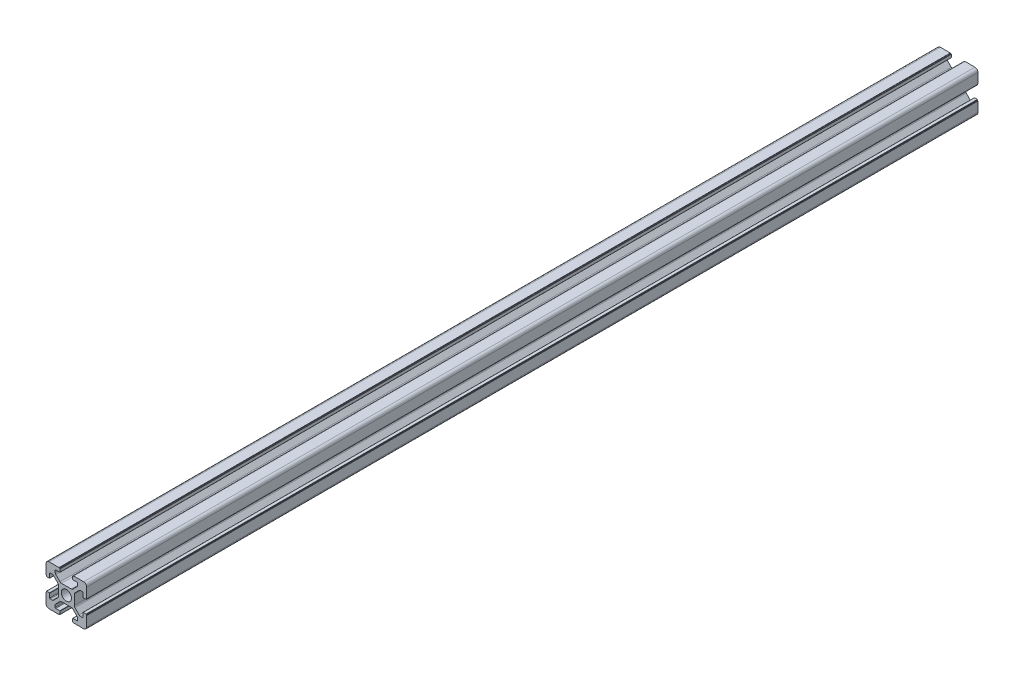
from build123d import *

# Parameters (mm, degrees)
SKETCH_1_R      = 2.5
EXTRUDE_1_DEPTH = 438
FILLET_1_R      = 1.5


with BuildPart() as part:
    # 草图1 → 凸台-拉伸1 (new body)
    with BuildSketch(Plane.XY):
        with BuildLine():
            Line((20, 13.6), (20, 20))
            Line((20, 20), (13.6, 20))
            Line((13.6, 20), (13.6, 19.8))
            Line((13.6, 19.8), (13.2, 19.8))
            ThreePointArc((13.2, 19.8), (13.129289322, 19.770710678), (13.1, 19.7))
            Line((13.1, 19.7), (13.1, 18.3))
            ThreePointArc((13.1, 18.3), (13.129289322, 18.229289322), (13.2, 18.2))
            Line((13.2, 18.2), (15.2, 18.2))
            ThreePointArc((15.2, 18.2), (15.412132034, 18.112132034), (15.5, 17.9))
            Line((15.5, 17.9), (15.5, 16.974873734))
            ThreePointArc((15.5, 16.974873734), (15.423879533, 16.592190302), (15.207106781, 16.267766953))
            Line((15.207106781, 16.267766953), (13.132233047, 14.192893219))
            ThreePointArc((13.132233047, 14.192893219), (12.807809698, 13.976120467), (12.425126266, 13.9))
            Line((12.425126266, 13.9), (7.574873734, 13.9))
            ThreePointArc((7.574873734, 13.9), (7.192190302, 13.976120467), (6.867766953, 14.192893219))
            Line((6.867766953, 14.192893219), (4.792893219, 16.267766953))
            ThreePointArc((4.792893219, 16.267766953), (4.576120467, 16.592190302), (4.5, 16.974873734))
            Line((4.5, 16.974873734), (4.5, 17.9))
            ThreePointArc((4.5, 17.9), (4.587867966, 18.112132034), (4.8, 18.2))
            Line((4.8, 18.2), (6.8, 18.2))
            ThreePointArc((6.8, 18.2), (6.870710678, 18.229289322), (6.9, 18.3))
            Line((6.9, 18.3), (6.9, 19.7))
            ThreePointArc((6.9, 19.7), (6.870710678, 19.770710678), (6.8, 19.8))
            Line((6.8, 19.8), (6.4, 19.8))
            Line((6.4, 19.8), (6.4, 20))
            Line((6.4, 20), (0, 20))
            Line((0, 20), (0, 13.6))
            Line((0, 13.6), (0.2, 13.6))
            Line((0.2, 13.6), (0.2, 13.2))
            ThreePointArc((0.2, 13.2), (0.229289322, 13.129289322), (0.3, 13.1))
            Line((0.3, 13.1), (1.7, 13.1))
            ThreePointArc((1.7, 13.1), (1.770710678, 13.129289322), (1.8, 13.2))
            Line((1.8, 13.2), (1.8, 15.2))
            ThreePointArc((1.8, 15.2), (1.887867966, 15.412132034), (2.1, 15.5))
            Line((2.1, 15.5), (3.025126266, 15.5))
            ThreePointArc((3.025126266, 15.5), (3.407809698, 15.423879533), (3.732233047, 15.207106781))
            Line((3.732233047, 15.207106781), (5.807106781, 13.132233047))
            ThreePointArc((5.807106781, 13.132233047), (6.023879533, 12.807809698), (6.1, 12.425126266))
            Line((6.1, 12.425126266), (6.1, 7.574873734))
            ThreePointArc((6.1, 7.574873734), (6.023879533, 7.192190302), (5.807106781, 6.867766953))
            Line((5.807106781, 6.867766953), (3.732233047, 4.792893219))
            ThreePointArc((3.732233047, 4.792893219), (3.407809698, 4.576120467), (3.025126266, 4.5))
            Line((3.025126266, 4.5), (2.1, 4.5))
            ThreePointArc((2.1, 4.5), (1.887867966, 4.587867966), (1.8, 4.8))
            Line((1.8, 4.8), (1.8, 6.8))
            ThreePointArc((1.8, 6.8), (1.770710678, 6.870710678), (1.7, 6.9))
            Line((1.7, 6.9), (0.3, 6.9))
            ThreePointArc((0.3, 6.9), (0.229289322, 6.870710678), (0.2, 6.8))
            Line((0.2, 6.8), (0.2, 6.4))
            Line((0.2, 6.4), (0, 6.4))
            Line((0, 6.4), (0, 0))
            Line((0, 0), (6.4, 0))
            Line((6.4, 0), (6.4, 0.2))
            Line((6.4, 0.2), (6.8, 0.2))
            ThreePointArc((6.8, 0.2), (6.870710678, 0.229289322), (6.9, 0.3))
            Line((6.9, 0.3), (6.9, 1.7))
            ThreePointArc((6.9, 1.7), (6.870710678, 1.770710678), (6.8, 1.8))
            Line((6.8, 1.8), (4.8, 1.8))
            ThreePointArc((4.8, 1.8), (4.587867966, 1.887867966), (4.5, 2.1))
            Line((4.5, 2.1), (4.5, 3.025126266))
            ThreePointArc((4.5, 3.025126266), (4.576120467, 3.407809698), (4.792893219, 3.732233047))
            Line((4.792893219, 3.732233047), (6.867766953, 5.807106781))
            ThreePointArc((6.867766953, 5.807106781), (7.192190302, 6.023879533), (7.574873734, 6.1))
            Line((7.574873734, 6.1), (12.425126266, 6.1))
            ThreePointArc((12.425126266, 6.1), (12.807809698, 6.023879533), (13.132233047, 5.807106781))
            Line((13.132233047, 5.807106781), (15.207106781, 3.732233047))
            ThreePointArc((15.207106781, 3.732233047), (15.423879533, 3.407809698), (15.5, 3.025126266))
            Line((15.5, 3.025126266), (15.5, 2.1))
            ThreePointArc((15.5, 2.1), (15.412132034, 1.887867966), (15.2, 1.8))
            Line((15.2, 1.8), (13.2, 1.8))
            ThreePointArc((13.2, 1.8), (13.129289322, 1.770710678), (13.1, 1.7))
            Line((13.1, 1.7), (13.1, 0.3))
            ThreePointArc((13.1, 0.3), (13.129289322, 0.229289322), (13.2, 0.2))
            Line((13.2, 0.2), (13.6, 0.2))
            Line((13.6, 0.2), (13.6, 0))
            Line((13.6, 0), (20, 0))
            Line((20, 0), (20, 6.4))
            Line((20, 6.4), (19.8, 6.4))
            Line((19.8, 6.4), (19.8, 6.8))
            ThreePointArc((19.8, 6.8), (19.770710678, 6.870710678), (19.7, 6.9))
            Line((19.7, 6.9), (18.3, 6.9))
            ThreePointArc((18.3, 6.9), (18.229289322, 6.870710678), (18.2, 6.8))
            Line((18.2, 6.8), (18.2, 4.8))
            ThreePointArc((18.2, 4.8), (18.112132034, 4.587867966), (17.9, 4.5))
            Line((17.9, 4.5), (16.974873734, 4.5))
            ThreePointArc((16.974873734, 4.5), (16.592190302, 4.576120467), (16.267766953, 4.792893219))
            Line((16.267766953, 4.792893219), (14.192893219, 6.867766953))
            ThreePointArc((14.192893219, 6.867766953), (13.976120467, 7.192190302), (13.9, 7.574873734))
            Line((13.9, 7.574873734), (13.9, 12.425126266))
            ThreePointArc((13.9, 12.425126266), (13.976120467, 12.807809698), (14.192893219, 13.132233047))
            Line((14.192893219, 13.132233047), (16.267766953, 15.207106781))
            ThreePointArc((16.267766953, 15.207106781), (16.592190302, 15.423879533), (16.974873734, 15.5))
            Line((16.974873734, 15.5), (17.9, 15.5))
            ThreePointArc((17.9, 15.5), (18.112132034, 15.412132034), (18.2, 15.2))
            Line((18.2, 15.2), (18.2, 13.2))
            ThreePointArc((18.2, 13.2), (18.229289322, 13.129289322), (18.3, 13.1))
            Line((18.3, 13.1), (19.7, 13.1))
            ThreePointArc((19.7, 13.1), (19.770710678, 13.129289322), (19.8, 13.2))
            Line((19.8, 13.2), (19.8, 13.6))
            Line((19.8, 13.6), (20, 13.6))
        make_face()
        with Locations((10, 10)):
            Circle(SKETCH_1_R, mode=Mode.SUBTRACT)
    extrude(amount=EXTRUDE_1_DEPTH)

    # 圆角1
    fillet_1_edges = [part.edges().sort_by_distance(p)[0] for p in [
        (0, 0, 219),
        (0, 20, 219),
        (20, 20, 219),
        (20, 0, 219),
    ]]
    fillet(fillet_1_edges, radius=FILLET_1_R)


solid = part.part
